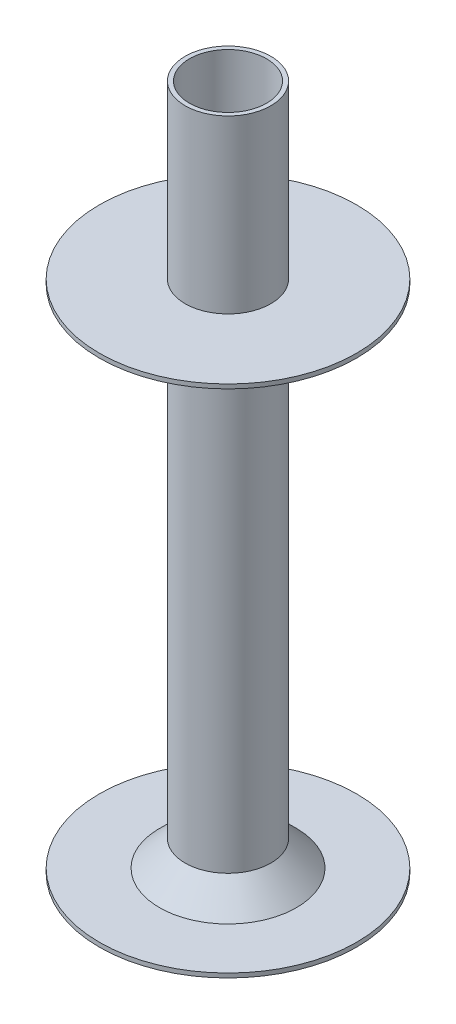
from build123d import *

# Parameters (mm, degrees)
SKETCH1_R           = 50
BOSS_EXTRUDE1_DEPTH = 800
SKETCH3_R           = 45
CUT_EXTRUDE1_DEPTH  = 828.647267862


with BuildPart() as part:
    # Sketch1 → Boss-Extrude1 (new body)
    with BuildSketch(Plane(origin=(0, 0, 0), x_dir=(1, 0, 0), z_dir=(0, 1, 0))):
        with Locations(Location((0, 0, 0), (0, 0, 270))):
            Circle(SKETCH1_R)
    extrude(amount=BOSS_EXTRUDE1_DEPTH)

    # Sketch2 → Revolve1 (revolve)
    with BuildSketch(Plane.XY, mode=Mode.PRIVATE) as revolve1_sk:
        Polygon((0, 0), (150, 0), (150, 5), (80, 5), (0, 85), align=None)
        Polygon((0, 600), (150, 600), (150, 595), (80, 595), (0, 515), align=None)
    revolve(revolve1_sk.sketch.rotate(Axis((0, -31.169915786, 0), (0, 1, 0)), 90), axis=Axis((0, -31.169915786, 0), (0, 1, 0)))

    # Sketch3 → Cut-Extrude1 (cut, through all)
    with BuildSketch(Plane(origin=(0, 800, 0), x_dir=(1, 0, 0), z_dir=(0, 1, 0))):
        with Locations(Location((0, 0, 0), (0, 0, 270))):
            Circle(SKETCH3_R)
    extrude(amount=-CUT_EXTRUDE1_DEPTH, mode=Mode.SUBTRACT)


solid = part.part
